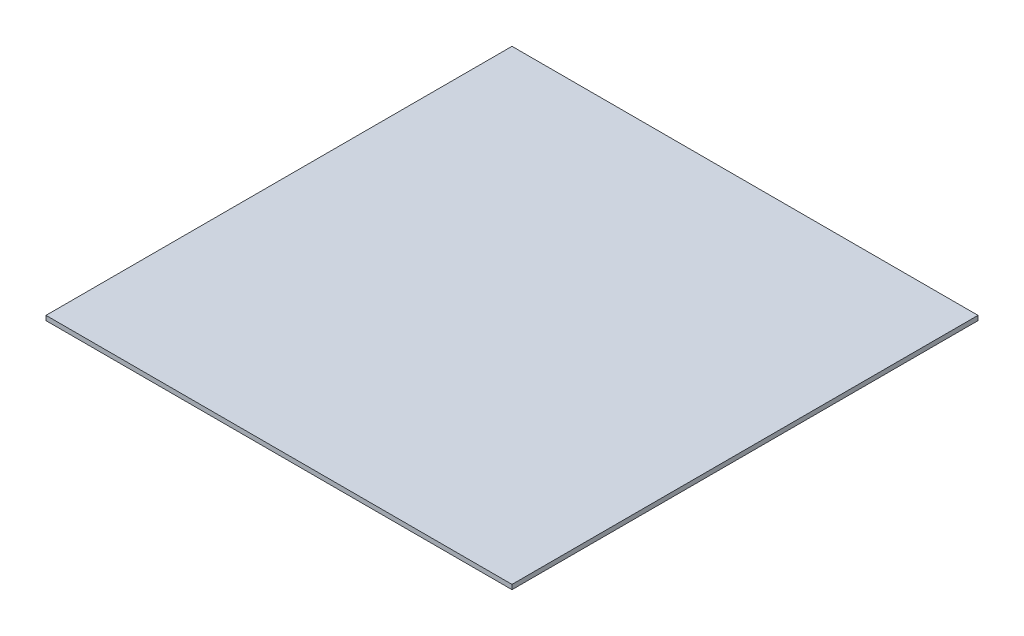
from build123d import *

# Parameters (mm, degrees)
SKETCH1_W           = 202
SKETCH1_H           = 202
BOSS_EXTRUDE1_DEPTH = 2


with BuildPart() as part:
    # Sketch1 → Boss-Extrude1 (new body)
    with BuildSketch(Plane(origin=(0, 0, 0), x_dir=(1, 0, 0), z_dir=(0, 1, 0))):
        Rectangle(SKETCH1_W, SKETCH1_H)
    extrude(amount=BOSS_EXTRUDE1_DEPTH)


solid = part.part
